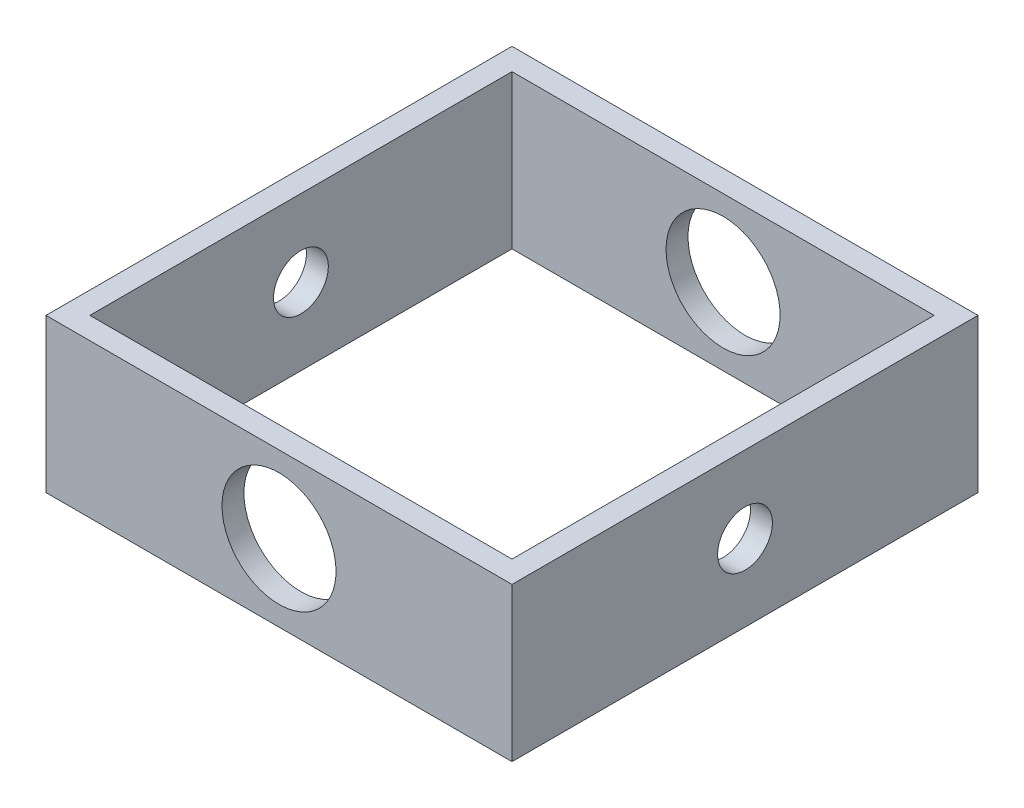
from build123d import *

# Parameters (mm, degrees)
SKETCH1_W           = 26.9875
SKETCH1_H           = 26.9875
SKETCH1_W_2         = 24.4475
SKETCH1_H_2         = 24.4475
BOSS_EXTRUDE1_DEPTH = 8.89
SKETCH2_R           = 1.5875
CUT_EXTRUDE1_DEPTH  = 152.4
SKETCH3_R           = 3.302
CUT_EXTRUDE3_DEPTH  = 152.4


with BuildPart() as part:
    # Sketch1 → Boss-Extrude1 (new body)
    with BuildSketch(Plane(origin=(0, 0, 0), x_dir=(1, 0, 0), z_dir=(0, 1, 0))):
        Rectangle(SKETCH1_W, SKETCH1_H)
        Rectangle(SKETCH1_W_2, SKETCH1_H_2, mode=Mode.SUBTRACT)
    extrude(amount=BOSS_EXTRUDE1_DEPTH)

    # Sketch2 → Cut-Extrude1 (cut)
    with BuildSketch(Plane(origin=(13.49375, 0, 0), x_dir=(0, 0, -1), z_dir=(1, 0, 0))):
        with Locations((0, 4.445)):
            Circle(SKETCH2_R)
    extrude(amount=-CUT_EXTRUDE1_DEPTH, mode=Mode.SUBTRACT)

    # Sketch3 → Cut-Extrude3 (cut)
    with BuildSketch(Plane(origin=(0, 0, -13.49375), x_dir=(-1, 0, 0), z_dir=(0, 0, -1))):
        with Locations((0, 4.445)):
            Circle(SKETCH3_R)
    extrude(amount=-CUT_EXTRUDE3_DEPTH, mode=Mode.SUBTRACT)


solid = part.part
